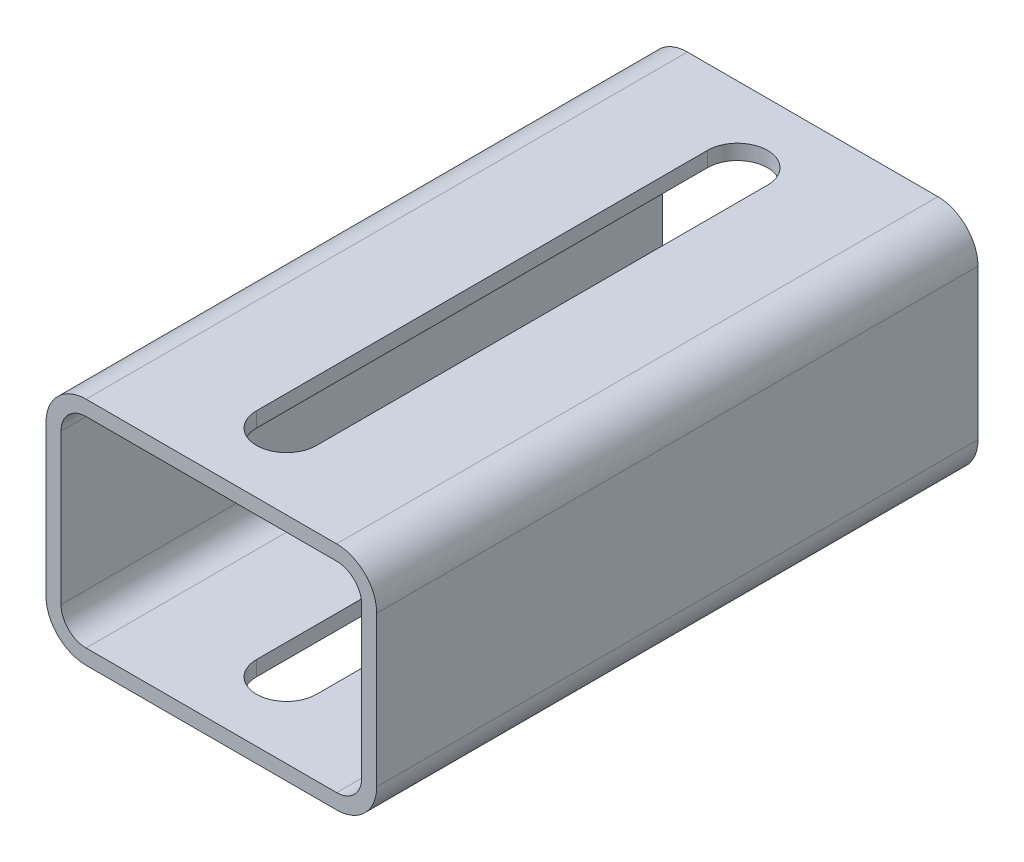
from build123d import *

# Parameters (mm, degrees)
EXTRUDE_THIN1_DEPTH = 60
CUT_EXTRUDE1_DEPTH  = 83.492423895


with BuildPart() as part:
    # Sketch1 → Extrude-Thin1 (new, symmetric)
    with BuildSketch(Plane.XY):
        with BuildLine():
            Line((-33, 15), (-33, -15))
            ThreePointArc((-33, -15), (-30.656854249, -20.656854249), (-25, -23))
            Line((-25, -23), (25, -23))
            ThreePointArc((25, -23), (30.656854249, -20.656854249), (33, -15))
            Line((33, -15), (33, 15))
            ThreePointArc((33, 15), (30.656854249, 20.656854249), (25, 23))
            Line((25, 23), (-25, 23))
            ThreePointArc((-25, 23), (-30.656854249, 20.656854249), (-33, 15))
        make_face()
        with BuildLine():
            Line((-30, 15), (-30, -15))
            ThreePointArc((-30, -15), (-28.535533906, -18.535533906), (-25, -20))
            Line((-25, -20), (25, -20))
            ThreePointArc((25, -20), (28.535533906, -18.535533906), (30, -15))
            Line((30, -15), (30, 15))
            ThreePointArc((30, 15), (28.535533906, 18.535533906), (25, 20))
            Line((25, 20), (-25, 20))
            ThreePointArc((-25, 20), (-28.535533906, 18.535533906), (-30, 15))
        make_face(mode=Mode.SUBTRACT)
    extrude(amount=EXTRUDE_THIN1_DEPTH, both=True)

    # Sketch2 → Cut-Extrude1 (cut, through all)
    with BuildSketch(Plane(origin=(0, 23, 0), x_dir=(1, 0, 0), z_dir=(0, 1, 0))):
        with BuildLine():
            Line((6, 45), (6, -45))
            ThreePointArc((6, -45), (0, -51), (-6, -45))
            Line((-6, -45), (-6, 45))
            ThreePointArc((-6, 45), (0, 51), (6, 45))
        make_face()
    extrude(amount=-CUT_EXTRUDE1_DEPTH, mode=Mode.SUBTRACT)


solid = part.part
